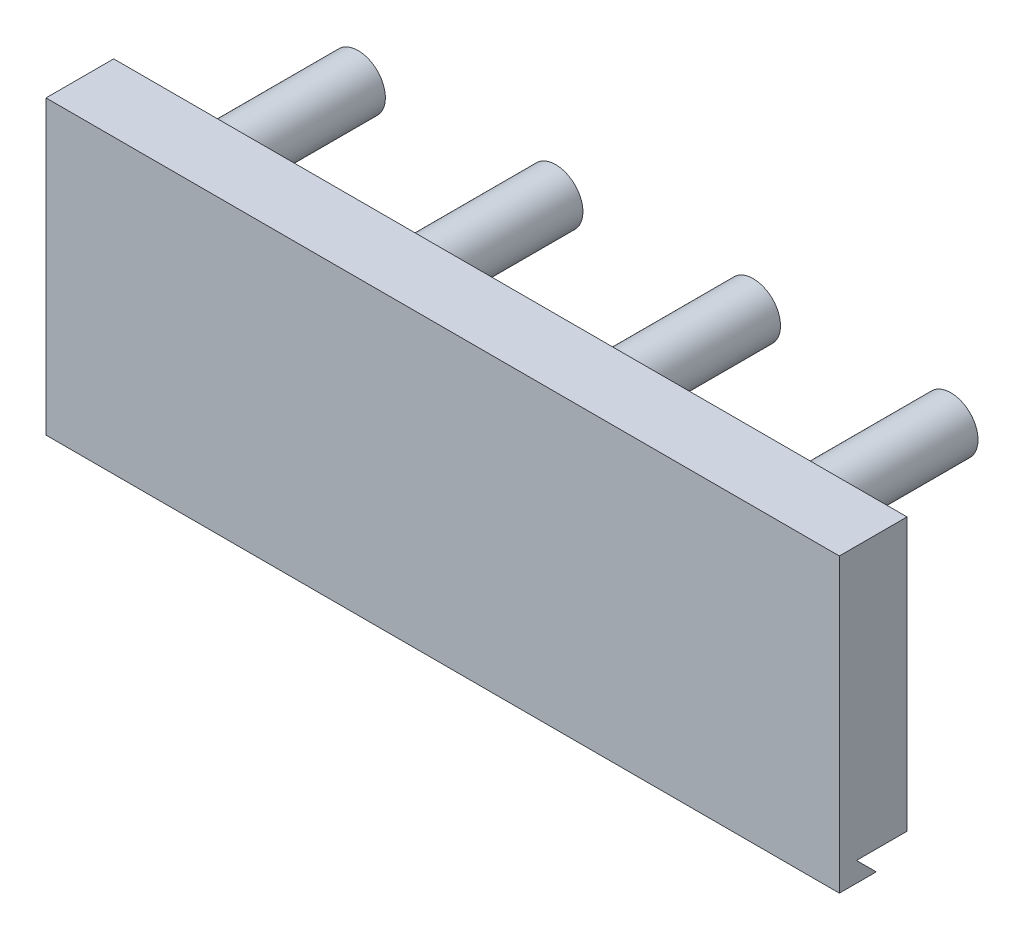
from build123d import *

# Parameters (mm, degrees)
SKETCH1_W           = 102
SKETCH1_H           = 35
BOSS_EXTRUDE1_DEPTH = 8.7
BOSS_EXTRUDE2_DEPTH = 102
SKETCH5_R           = 3.5
BOSS_EXTRUDE3_DEPTH = 20


with BuildPart() as part:
    # Sketch1 → Boss-Extrude1 (new body)
    with BuildSketch(Plane.XY):
        Rectangle(SKETCH1_W, SKETCH1_H)
    extrude(amount=BOSS_EXTRUDE1_DEPTH)

    # Sketch4 → Boss-Extrude2 (add)
    with BuildSketch(Plane.ZY.offset(51)):
        Polygon((6.5, -17.5), (8.7, -17.5), (8.7, -20.045584412), (3.954415588, -20.045584412), align=None)
    extrude(amount=-BOSS_EXTRUDE2_DEPTH)

    # Sketch5 → Boss-Extrude3 (add)
    with BuildSketch(Plane(origin=(0, 0, 0), x_dir=(-1, 0, 0), z_dir=(0, 0, -1))):
        with Locations((-36.63, 10.64)):
            Circle(SKETCH5_R)
        with Locations((-11.23, 10.64)):
            Circle(SKETCH5_R)
        with Locations((14.17, 10.64)):
            Circle(SKETCH5_R)
        with Locations((39.57, 10.64)):
            Circle(SKETCH5_R)
    extrude(amount=BOSS_EXTRUDE3_DEPTH)


solid = part.part
